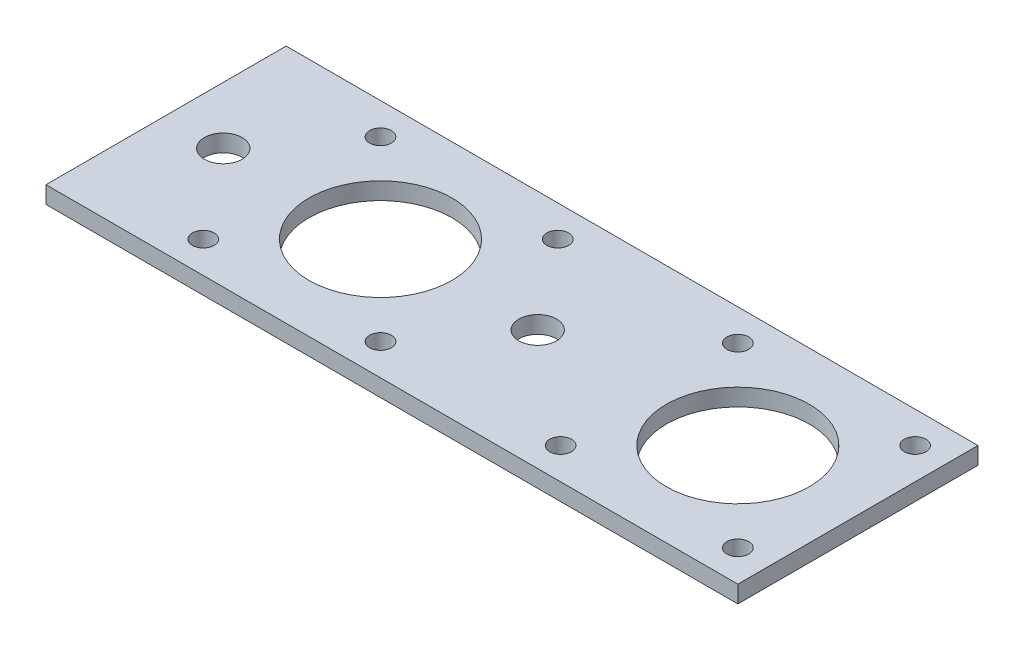
from build123d import *

# Parameters (mm, degrees)
SKETCH_1_W      = 75
SKETCH_1_H      = 42
EXTRUDE_1_DEPTH = 3
HOLE_WIZARD_1_D = 3.8
HOLE_WIZARD_2_D = 6.6
HOLE_WIZARD_3_D = 25
EXTRUDE_2_DEPTH = 3
HOLE_WIZARD_4_D = 3.8
HOLE_WIZARD_5_D = 25


with BuildPart() as part:
    # 草图1 → 凸台-拉伸1 (new body)
    with BuildSketch(Plane(origin=(0, 0, 0), x_dir=(1, 0, 0), z_dir=(0, 1, 0))):
        with Locations((37.5, 21)):
            Rectangle(SKETCH_1_W, SKETCH_1_H)
    extrude(amount=EXTRUDE_1_DEPTH)

    # 孔1 (through all)
    with Locations(Plane(origin=(0, 3, 0), x_dir=(1, 0, 0), z_dir=(0, 1, 0))):
        with Locations((22, 36.5), (53, 36.5), (53, 5.5), (22, 5.5)):
            Hole(HOLE_WIZARD_1_D / 2)

    # 孔2 (through all)
    with Locations(Plane(origin=(0, 3, 0), x_dir=(1, 0, 0), z_dir=(0, 1, 0))):
        with Locations((10, 21), (65, 21)):
            Hole(HOLE_WIZARD_2_D / 2)

    # 孔3 (through all)
    with Locations(Plane(origin=(0, 3, 0), x_dir=(1, 0, 0), z_dir=(0, 1, 0))):
        with Locations((37.5, 21)):
            Hole(HOLE_WIZARD_3_D / 2)

    # 草图9 → 凸台-拉伸2 (add)
    with BuildSketch(Plane(origin=(0, 3, 0), x_dir=(1, 0, 0), z_dir=(0, 1, 0))):
        Polygon((121, 42), (75, 42), (75, 21), (75, 0), (121, 0), align=None)
    extrude(amount=-EXTRUDE_2_DEPTH)

    # 孔4 (through all)
    with Locations(Plane(origin=(0, 3, 0), x_dir=(1, 0, 0), z_dir=(0, 1, 0))):
        with Locations((84.5, 36.5), (115.5, 36.5), (115.5, 5.5), (84.5, 5.5)):
            Hole(HOLE_WIZARD_4_D / 2)

    # 孔5 (through all)
    with Locations(Plane(origin=(0, 3, 0), x_dir=(1, 0, 0), z_dir=(0, 1, 0))):
        with Locations((100, 21)):
            Hole(HOLE_WIZARD_5_D / 2)


solid = part.part
